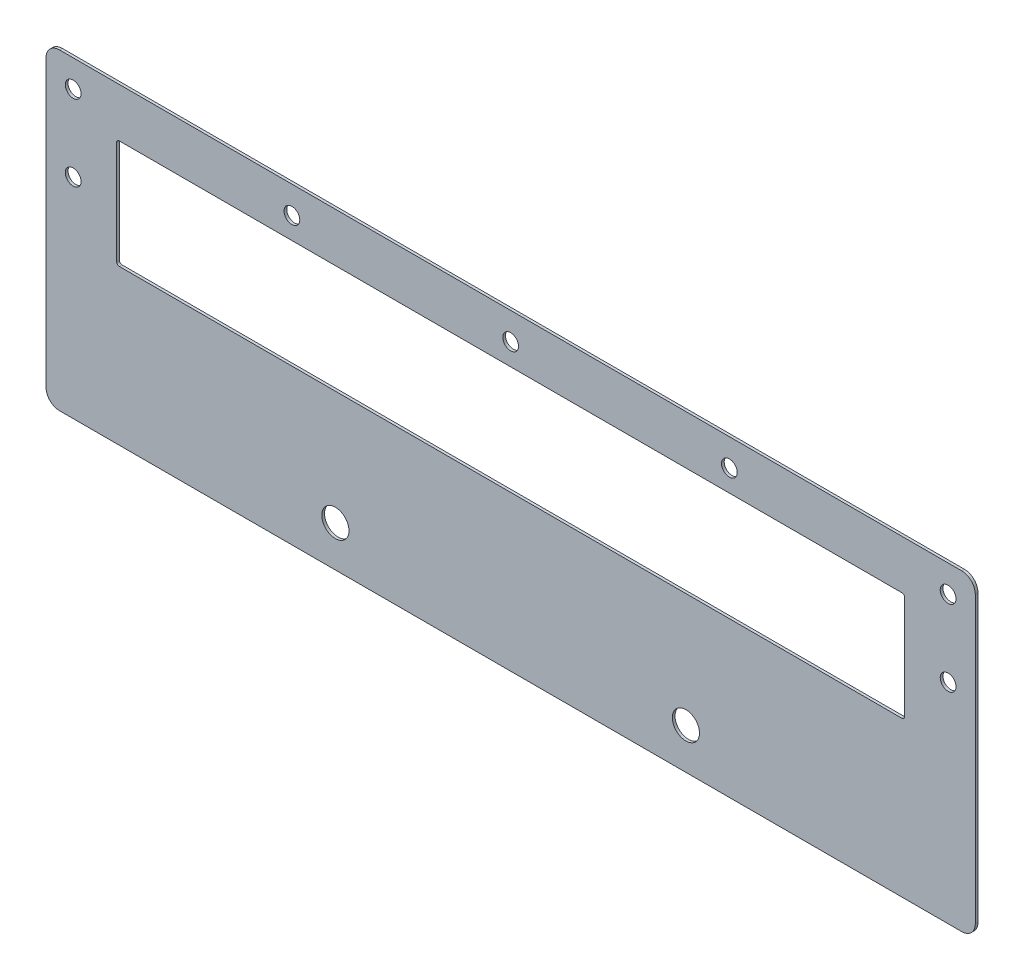
from build123d import *

# Parameters (mm, degrees)
SKETCH1_W            = 342
SKETCH1_H            = 115
SKETCH1_W_2          = 290
SKETCH1_H_2          = 40
BOSS_EXTRUDE1_DEPTH  = 1
FILLET1_R            = 5
FILLET2_R            = 1
M5_CLEARANCE_HOLE1_D = 5.8
M8_CLEARANCE_HOLE1_D = 10


with BuildPart() as part:
    # Sketch1 → Boss-Extrude1 (new body)
    with BuildSketch(Plane.XY):
        Rectangle(SKETCH1_W, SKETCH1_H)
        with Locations((0, 19.5)):
            Rectangle(SKETCH1_W_2, SKETCH1_H_2, mode=Mode.SUBTRACT)
    extrude(amount=BOSS_EXTRUDE1_DEPTH)

    # Fillet1
    fillet1_edges = [part.edges().sort_by_distance(p)[0] for p in [
        (-171, 57.5, 0.5),
        (171, 57.5, 0.5),
        (171, -57.5, 0.5),
        (-171, -57.5, 0.5),
    ]]
    fillet(fillet1_edges, radius=FILLET1_R)

    # Fillet2
    fillet2_edges = [part.edges().sort_by_distance(p)[0] for p in [
        (-145, -0.5, 0.5),
        (145, -0.5, 0.5),
        (145, 39.5, 0.5),
        (-145, 39.5, 0.5),
    ]]
    fillet(fillet2_edges, radius=FILLET2_R)

    # M5 Clearance Hole1 (through all)
    with Locations(Plane.XY.offset(1)):
        with Locations((-161, 47.5), (-161, 19.5), (-80.5, 47.5), (0, 47.5), (80.5, 47.5), (161, 47.5), (161, 19.5)):
            Hole(M5_CLEARANCE_HOLE1_D / 2)

    # M8 Clearance Hole1 (through all)
    with Locations(Plane.XY.offset(1)):
        with Locations((-64.5, -42.5), (64.5, -42.5)):
            Hole(M8_CLEARANCE_HOLE1_D / 2)


solid = part.part
